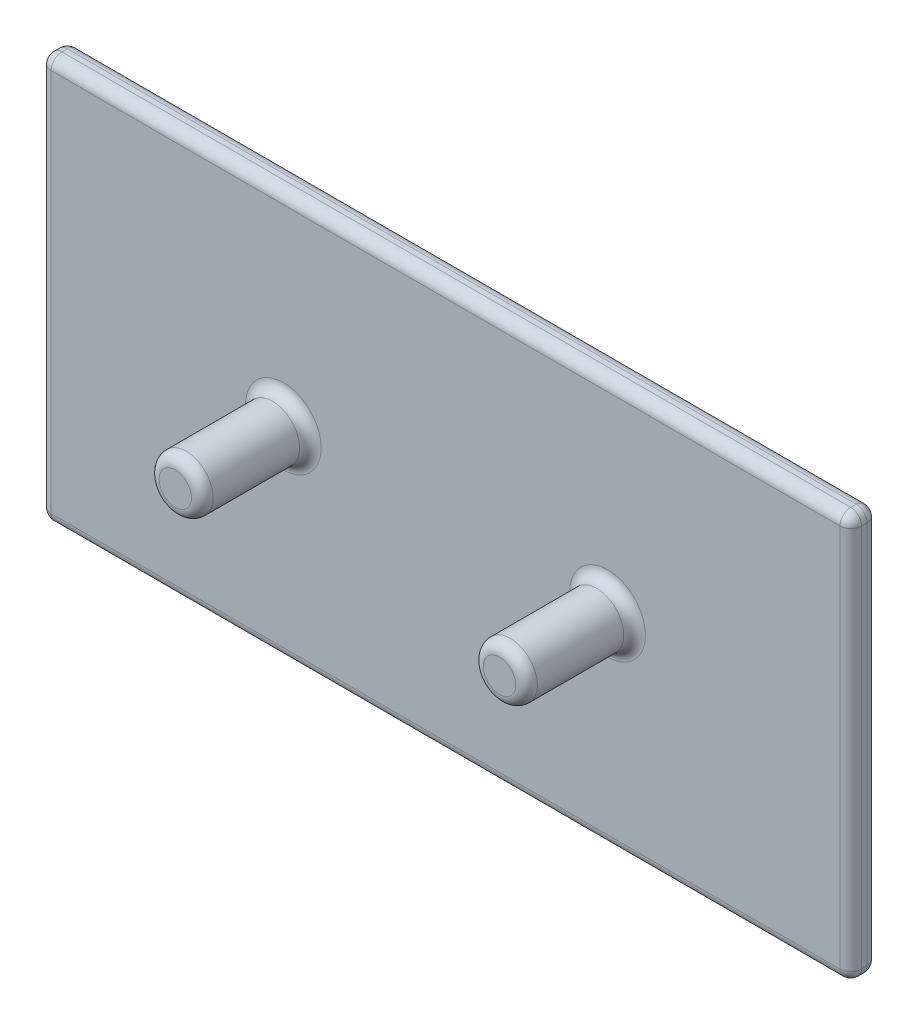
from build123d import *

# Parameters (mm, degrees)
SKETCH_1_W      = 300
SKETCH_1_H      = 150
EXTRUDE_1_DEPTH = 10
SKETCH_2_R      = 10
EXTRUDE_2_DEPTH = 40
FILLET_1_R      = 4


with BuildPart() as part:
    # 草圖1 → 填料-伸長1 (new body)
    with BuildSketch(Plane.XY):
        with Locations((150, 75)):
            Rectangle(SKETCH_1_W, SKETCH_1_H)
    extrude(amount=EXTRUDE_1_DEPTH)

    # 草圖2 → 填料-伸長2 (add)
    with BuildSketch(Plane.XY.offset(10)):
        with Locations(Location((90, 75, 0), (0, 0, 180))):
            Circle(SKETCH_2_R)
        with Locations(Location((210, 75, 0), (0, 0, 180))):
            Circle(SKETCH_2_R)
    extrude(amount=EXTRUDE_2_DEPTH)

    # 圓角1
    fillet_1_edges = [part.edges().sort_by_distance(p)[0] for p in [
        (300, 75, 10),
        (150, 150, 10),
        (100, 75, 10),
        (100, 75, 50),
        (220, 75, 10),
        (220, 75, 50),
        (0, 75, 10),
        (150, 150, 0),
        (300, 75, 0),
        (150, 0, 0),
        (0, 75, 0),
        (150, 0, 10),
        (0, 150, 5),
        (300, 150, 5),
        (300, 0, 5),
        (0, 0, 5),
    ]]
    fillet(fillet_1_edges, radius=FILLET_1_R)


solid = part.part
